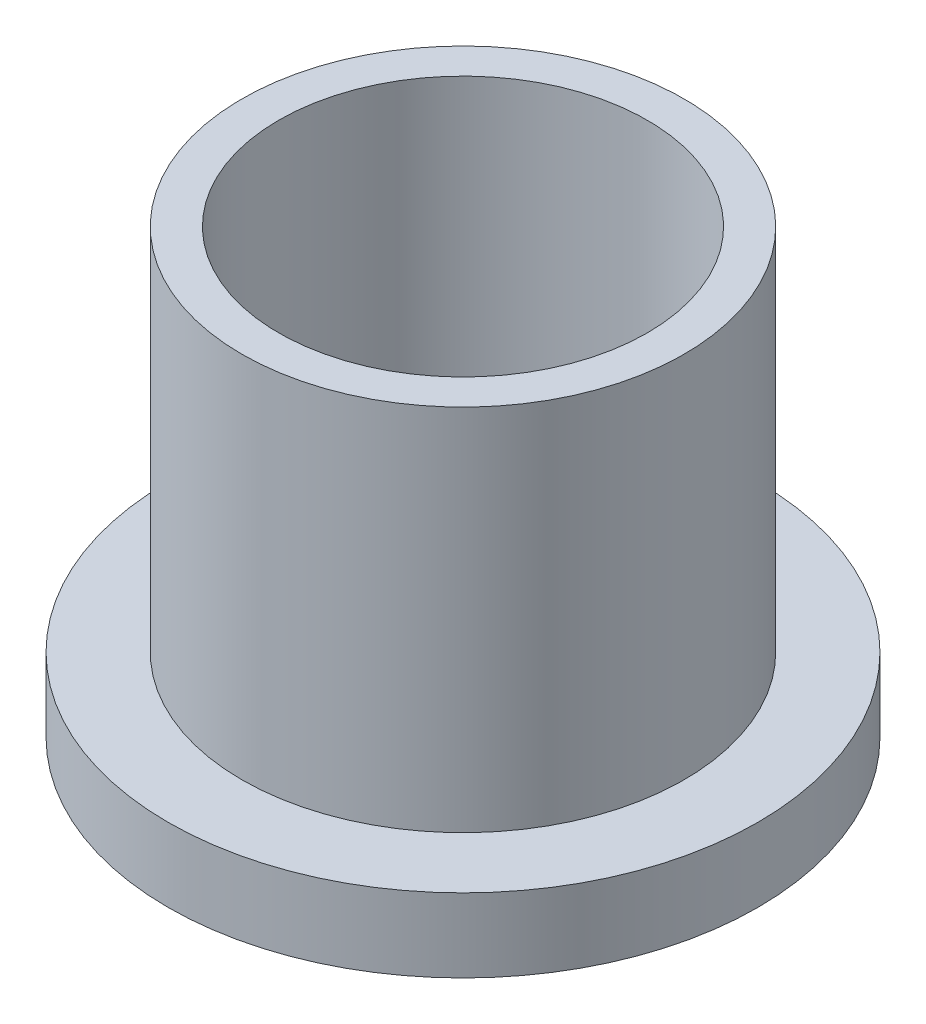
from build123d import *

# Parameters (mm, degrees)
ESQUISSE1_R    = 6
ESQUISSE1_R_2  = 5
CYLINDRE_DEPTH = 10
ESQUISSE2_R    = 8
BASE_DEPTH     = 2


with BuildPart() as part:
    # Esquisse1 → Cylindre (new body)
    with BuildSketch(Plane(origin=(0, 0, 0), x_dir=(1, 0, 0), z_dir=(0, 1, 0))):
        Circle(ESQUISSE1_R)
        Circle(ESQUISSE1_R_2, mode=Mode.SUBTRACT)
    extrude(amount=CYLINDRE_DEPTH)

    # Esquisse2 → Base (add)
    with BuildSketch(Plane.XZ):
        with Locations(Location((0, 0, 0), (0, 0, 270))):
            Circle(ESQUISSE2_R)
    extrude(amount=BASE_DEPTH)


solid = part.part
